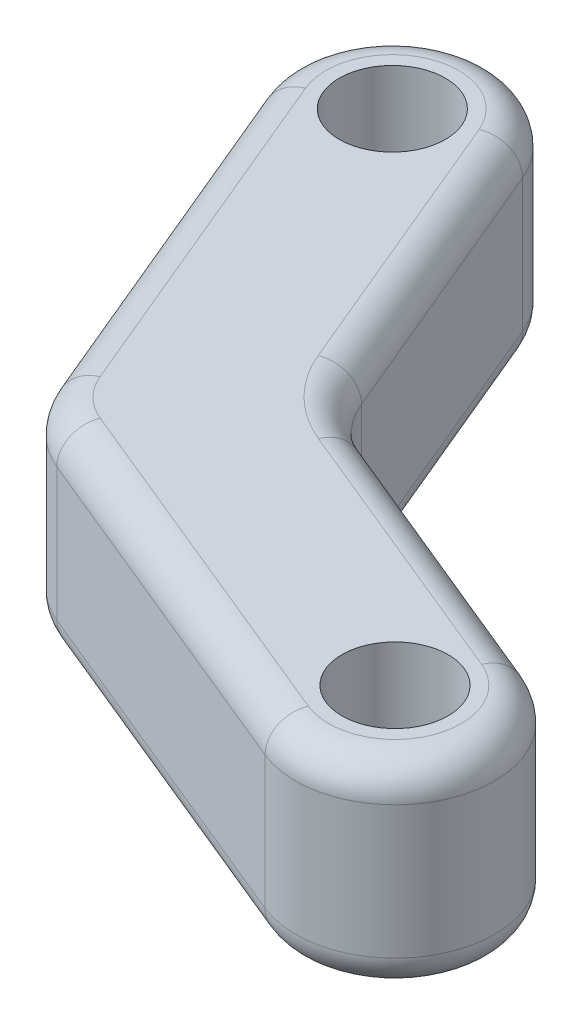
from build123d import *

# Parameters (mm, degrees)
SKETCH1_R           = 1.6
BOSS_EXTRUDE1_DEPTH = 6
FILLET2_R           = 1


with BuildPart() as part:
    # Sketch1 → Boss-Extrude1 (new body)
    with BuildSketch(Plane(origin=(0, 0, 0), x_dir=(1, 0, 0), z_dir=(0, 1, 0))):
        with BuildLine():
            Line((-17.848575481, 13.84458241), (-13.415177199, 3.22141215))
            ThreePointArc((-13.415177199, 3.22141215), (-12.76227277, 2.249875109), (-11.787276601, 1.60214763))
            Line((-11.787276601, 1.60214763), (-1.140674884, -2.77468211))
            ThreePointArc((-1.140674884, -2.77468211), (2.77468211, -1.140674884), (1.140674884, 2.77468211))
            Line((1.140674884, 2.77468211), (-7.207304912, 6.206545835))
            ThreePointArc((-7.207304912, 6.206545835), (-8.18230108, 6.854273314), (-8.835205509, 7.825810355))
            Line((-8.835205509, 7.825810355), (-12.311424519, 16.15541759))
            ThreePointArc((-12.311424519, 16.15541759), (-16.23541759, 17.768575481), (-17.848575481, 13.84458241))
        make_face()
        with Locations(Location((-15.08, 15, 0), (0, 0, 270))):
            Circle(SKETCH1_R, mode=Mode.SUBTRACT)
        with Locations(Location((0, 0, 0), (0, 0, 270))):
            Circle(SKETCH1_R, mode=Mode.SUBTRACT)
    extrude(amount=BOSS_EXTRUDE1_DEPTH)

    # Fillet2
    fillet2_edges = [part.edges().sort_by_distance(p)[0] for p in [
        (-15.63187634, 0, -8.53299728),
        (-16.23541759, 0, -17.768575481),
        (-10.573315014, 0, -11.990613972),
        (-8.18230108, 0, -6.854273314),
        (-16.23541759, 6, -17.768575481),
        (-15.63187634, 6, -8.53299728),
        (-12.76227277, 6, -2.249875109),
        (-6.463975743, 6, 0.58626724),
        (2.77468211, 6, 1.140674884),
        (-3.033315014, 6, -4.490613972),
        (-8.18230108, 6, -6.854273314),
        (-3.033315014, 0, -4.490613972),
        (-10.573315014, 6, -11.990613972),
        (2.77468211, 0, 1.140674884),
        (-6.463975743, 0, 0.58626724),
        (-12.76227277, 0, -2.249875109),
    ]]
    fillet(fillet2_edges, radius=FILLET2_R)


solid = part.part
